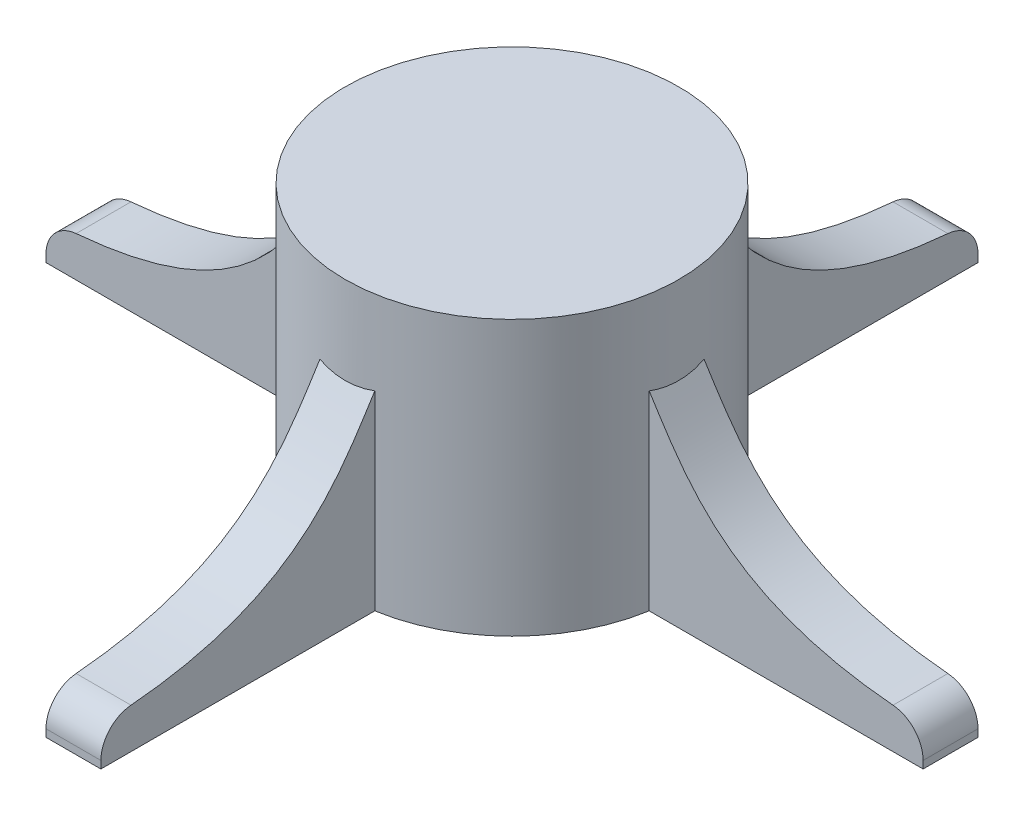
from build123d import *

# Parameters (mm, degrees)
SKETCH3_W           = 30
SKETCH3_H           = 5
SKETCH3_W_2         = 5
SKETCH3_H_2         = 30
BOSS_EXTRUDE2_DEPTH = 25
CUT_EXTRUDE2_DEPTH  = 35.003676272
BOSS_EXTRUDE3_DEPTH = 5
SKETCH9_W           = 12.5
SKETCH9_H           = 5
CUT_EXTRUDE3_DEPTH  = 50.460787365
CIRPATTERN9_COUNT   = 4
SKETCH11_W          = 30
SKETCH11_H          = 25
BOSS_EXTRUDE5_DEPTH = 2.5
FILLET1_R           = 3
BOSS_EXTRUDE6_REACH = 63.788
SKETCH12_R          = 15.206906326


with BuildPart() as part:
    # Sketch3 → Boss-Extrude2 (new body)
    with BuildSketch(Plane(origin=(0, 0, 0), x_dir=(1, 0, 0), z_dir=(0, 1, 0))):
        Rectangle(SKETCH3_W, SKETCH3_H)
        Rectangle(SKETCH3_W_2, SKETCH3_H_2)
    extrude(amount=BOSS_EXTRUDE2_DEPTH)

    # Sketch4 → Cut-Extrude2 (cut, symmetric)
    with BuildSketch(Plane(origin=(2.5, 0, 0), x_dir=(0, 0, -1), z_dir=(1, 0, 0))):
        with BuildLine():
            Line((-15, 25), (-15, 17.357377201))
            add(Edge.make_bspline(
                [(-15, 17.357377201), (-12.472140197, 21.356054213), (-10.128526377, 24.727998236), (-4.127581327, 25)],
                knots=[0.577139171, 0.577139171, 0.577139171, 0.577139171, 0.966590179, 0.966590179, 0.966590179, 0.966590179], degree=3))
            Line((-4.127581327, 25), (-15, 25))
        make_face()
    cut_extrude2 = extrude(amount=CUT_EXTRUDE2_DEPTH, both=True, mode=Mode.SUBTRACT)

    # Sketch5 → Boss-Extrude3 (add)
    with BuildSketch(Plane(origin=(2.5, 0, 0), x_dir=(0, 0, -1), z_dir=(1, 0, 0))):
        with BuildLine():
            Line((-39.95459265, 0), (-15, 0))
            Line((-15, 0), (-15, 17.357377201))
            add(Edge.make_bspline(
                [(-39.95459265, 3.5), (-22.896848779, 4.129478661), (-18.746111538, 11.431617363), (-15, 17.357377201)],
                knots=[0, 0, 0, 0, 0.577139171, 0.577139171, 0.577139171, 0.577139171], degree=3))
            Line((-39.95459265, 3.5), (-39.95459265, 0))
        make_face()
    boss_extrude3 = extrude(amount=-BOSS_EXTRUDE3_DEPTH)

    # Mirror1: Boss-Extrude3 across plane
    add(boss_extrude3.mirror(Plane.XY))

    # Mirror2: Cut-Extrude2 across plane
    add(cut_extrude2.mirror(Plane.XY), mode=Mode.SUBTRACT)

    # Sketch9 → Cut-Extrude3 (cut, through all)
    with BuildSketch(Plane(origin=(0, 25, 0), x_dir=(1, 0, 0), z_dir=(0, 1, 0))):
        with Locations((-8.75, 0)):
            Rectangle(SKETCH9_W, SKETCH9_H)
        with Locations((8.75, 0)):
            Rectangle(SKETCH9_W, SKETCH9_H)
    extrude(amount=-CUT_EXTRUDE3_DEPTH, mode=Mode.SUBTRACT)


with BuildPart() as cirpattern9_1:
    # CirPattern9: pattern copy
    add(part.part.rotate(Axis((0, 0, 0), (0, 1, 0)), 1 * 360 / CIRPATTERN9_COUNT))


with BuildPart() as cirpattern9_2:
    # CirPattern9: pattern copy
    add(part.part.rotate(Axis((0, 0, 0), (0, 1, 0)), 2 * 360 / CIRPATTERN9_COUNT))


with BuildPart() as cirpattern9_3:
    # CirPattern9: pattern copy
    add(part.part.rotate(Axis((0, 0, 0), (0, 1, 0)), 3 * 360 / CIRPATTERN9_COUNT))


with BuildPart() as part_1:
    add(part.part)

    add(cirpattern9_1.part)  # Boss-Extrude5 merges CirPattern9_1

    add(cirpattern9_2.part)  # Boss-Extrude5 merges CirPattern9_2

    add(cirpattern9_3.part)  # Boss-Extrude5 merges CirPattern9_3
    # Sketch11 → Boss-Extrude5 (add, symmetric)
    with BuildSketch(Plane(origin=(0, 0, 0), x_dir=(0.7071067811865489, 0, 0.7071067811865462), z_dir=(-0.7071067811865462, 0, 0.7071067811865489))):
        with Locations((0, 12.5)):
            Rectangle(SKETCH11_W, SKETCH11_H)
    extrude(amount=BOSS_EXTRUDE5_DEPTH, both=True)

    # Fillet1
    fillet1_edges = [part_1.edges().sort_by_distance(p)[0] for p in [
        (0, 3.5, -39.95459265),
        (39.95459265, 3.5, 0),
        (0, 3.5, 39.95459265),
        (-39.95459265, 3.5, 0),
    ]]
    fillet(fillet1_edges, radius=FILLET1_R)

    # Boss-Extrude6: up to this face of the body (flat: up to its plane)
    boss_extrude6_end = Plane(part_1.part.faces().sort_by_distance((0, 0, 0))[0])
    # Sketch12 → Boss-Extrude6 (add, up to the picked face)
    with BuildSketch(Plane(origin=(0, 25, 0), x_dir=(1, 0, 0), z_dir=(0, 1, 0)), mode=Mode.PRIVATE) as boss_extrude6_sk1:
        with Locations(Location((0, 0, 0), (0, 0, 270))):
            Circle(SKETCH12_R)
    boss_extrude6_tool1 = split(extrude(boss_extrude6_sk1.sketch, amount=-BOSS_EXTRUDE6_REACH, mode=Mode.PRIVATE), bisect_by=boss_extrude6_end, keep=Keep.BOTH, mode=Mode.PRIVATE)
    add(boss_extrude6_tool1.solids().sort_by(Axis((0, 25, 0), (0, -1, 0)))[0])


solid = part_1.part
